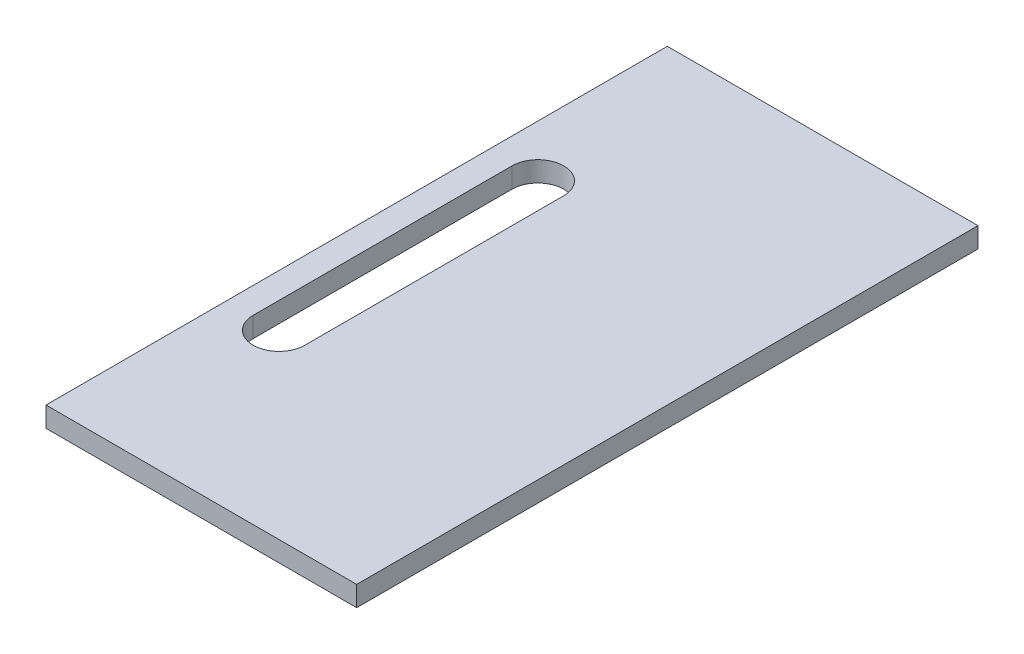
from build123d import *

# Parameters (mm, degrees)
SKETCH1_W           = 304.8
SKETCH1_H           = 609.6
BOSS_EXTRUDE1_DEPTH = 19.84375
CUT_EXTRUDE1_DEPTH  = 682.842338385


with BuildPart() as part:
    # Sketch1 → Boss-Extrude1 (new body)
    with BuildSketch(Plane(origin=(0, 0, 0), x_dir=(1, 0, 0), z_dir=(0, 1, 0))):
        with Locations((152.4, 304.8)):
            Rectangle(SKETCH1_W, SKETCH1_H)
    extrude(amount=BOSS_EXTRUDE1_DEPTH)

    # Sketch2 → Cut-Extrude1 (cut, through all)
    with BuildSketch(Plane(origin=(0, 19.84375, 0), x_dir=(1, 0, 0), z_dir=(0, 1, 0))):
        with BuildLine():
            Line((76.2, 431.8), (76.2, 177.8))
            ThreePointArc((76.2, 177.8), (50.8, 152.4), (25.4, 177.8))
            Line((25.4, 177.8), (25.4, 431.8))
            ThreePointArc((25.4, 431.8), (50.8, 457.2), (76.2, 431.8))
        make_face()
    extrude(amount=-CUT_EXTRUDE1_DEPTH, mode=Mode.SUBTRACT)


solid = part.part
